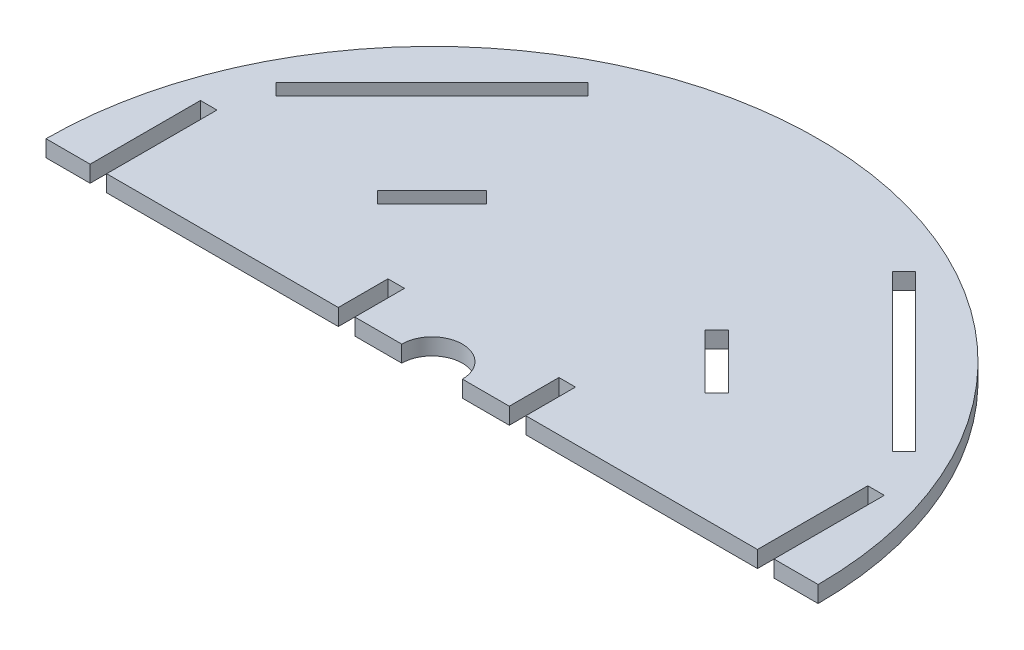
from build123d import *

# Parameters (mm, degrees)
SALIENTE_EXTRUIR1_DEPTH = 3


with BuildPart() as part:
    # Croquis1 → Saliente-Extruir1 (new body)
    with BuildSketch(Plane(origin=(0, 0, 0), x_dir=(1, 0, 0), z_dir=(0, 1, 0))):
        with BuildLine():
            Line((-59, 0), (-17, 0))
            Line((-17, 0), (-17, 9))
            Line((-17, 9), (-14, 9))
            Line((-14, 9), (-14, 0))
            Line((-14, 0), (-5.5, 0))
            ThreePointArc((-5.5, 0), (0, 5.5), (5.5, 0))
            Line((5.5, 0), (14, 0))
            Line((14, 0), (14, 9))
            Line((14, 9), (17, 9))
            Line((17, 9), (17, 0))
            Line((17, 0), (59, 0))
            Line((59, 0), (59, 20))
            Line((59, 20), (62, 20))
            Line((62, 20), (62, 0))
            Line((62, 0), (70, 0))
            ThreePointArc((70, 0), (0, 70), (-70, 0))
            Line((-70, 0), (-62, 0))
            Line((-62, 0), (-62, 20))
            Line((-62, 20), (-59, 20))
            Line((-59, 20), (-59, 0))
        make_face()
        Polygon((24.748737342, 24.748737342), (29.69848481, 19.798989873), (31.819805153, 21.920310217), (21.920310217, 31.819805153), (19.798989873, 29.69848481), align=None, mode=Mode.SUBTRACT)
        Polygon((-24.748737342, 24.748737342), (-19.798989873, 29.69848481), (-21.920310217, 31.819805153), (-31.819805153, 21.920310217), (-29.69848481, 19.798989873), align=None, mode=Mode.SUBTRACT)
        Polygon((55.861435714, 27.577164466), (27.577164466, 55.861435714), (29.69848481, 57.982756057), (43.840620434, 43.840620434), (57.982756057, 29.69848481), align=None, mode=Mode.SUBTRACT)
        Polygon((-27.577164466, 55.861435714), (-55.861435714, 27.577164466), (-57.982756057, 29.69848481), (-43.840620434, 43.840620434), (-29.69848481, 57.982756057), align=None, mode=Mode.SUBTRACT)
    extrude(amount=SALIENTE_EXTRUIR1_DEPTH)


solid = part.part
